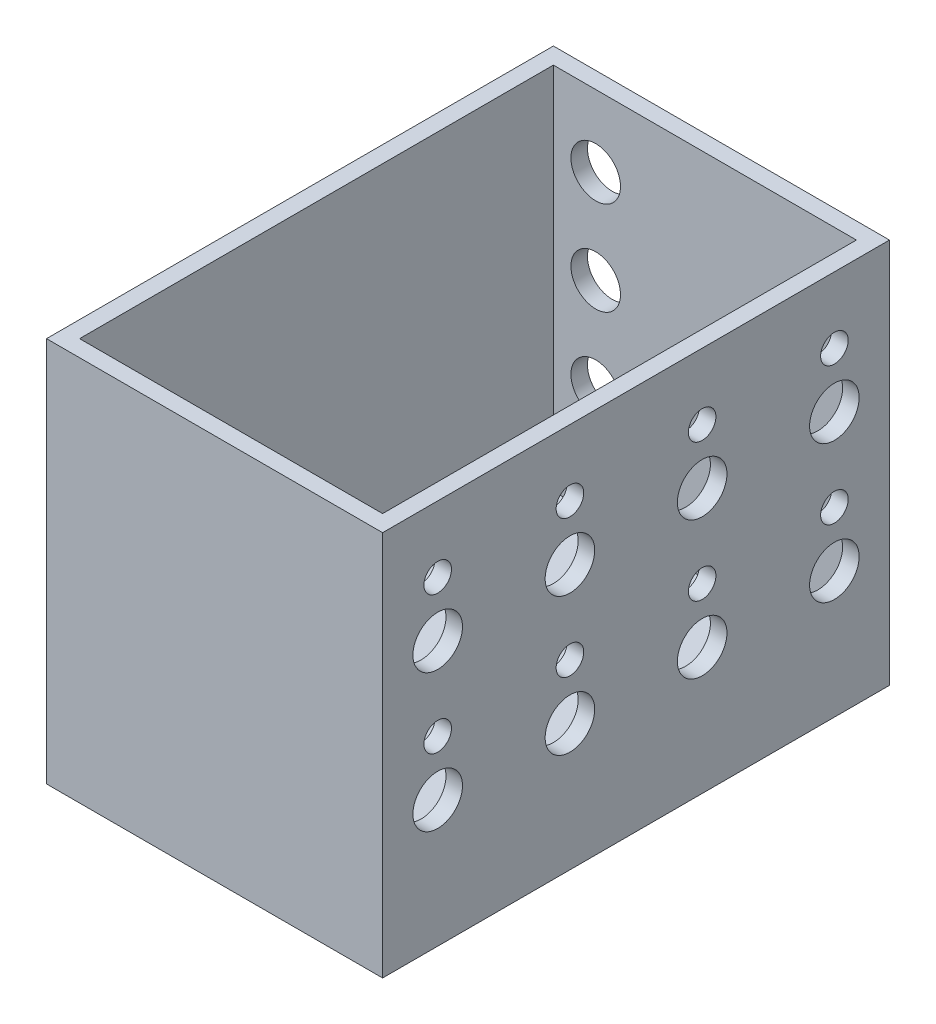
from build123d import *

# Parameters (mm, degrees)
SKETCH1_W           = 55
SKETCH1_H           = 86
BOSS_EXTRUDE1_DEPTH = 3
SKETCH2_W           = 45
SKETCH2_H           = 45
CUT_EXTRUDE1_DEPTH  = 1.5
SKETCH3_W           = 61
SKETCH3_H           = 92
SKETCH3_W_2         = 55
SKETCH3_H_2         = 86
BOSS_EXTRUDE2_DEPTH = 70
SKETCH4_R           = 4.5
SKETCH4_R_2         = 2.5
CUT_EXTRUDE2_DEPTH  = 3
SKETCH5_R           = 4.5
CUT_EXTRUDE3_DEPTH  = 3


with BuildPart() as part:
    # Sketch1 → Boss-Extrude1 (new body)
    with BuildSketch(Plane(origin=(0, 0, 0), x_dir=(1, 0, 0), z_dir=(0, 1, 0))):
        Rectangle(SKETCH1_W, SKETCH1_H)
    extrude(amount=BOSS_EXTRUDE1_DEPTH)

    # Sketch2 → Cut-Extrude1 (cut)
    with BuildSketch(Plane(origin=(0, 3, 0), x_dir=(1, 0, 0), z_dir=(0, 1, 0))):
        Rectangle(SKETCH2_W, SKETCH2_H)
    extrude(amount=-CUT_EXTRUDE1_DEPTH, mode=Mode.SUBTRACT)

    # Sketch3 → Boss-Extrude2 (add)
    with BuildSketch(Plane(origin=(0, 0, 0), x_dir=(1, 0, 0), z_dir=(0, 1, 0))):
        Rectangle(SKETCH3_W, SKETCH3_H)
        Rectangle(SKETCH3_W_2, SKETCH3_H_2, mode=Mode.SUBTRACT)
    extrude(amount=BOSS_EXTRUDE2_DEPTH)

    # Sketch4 → Cut-Extrude2 (cut)
    with BuildSketch(Plane(origin=(30.5, 0, 0), x_dir=(0, 0, -1), z_dir=(1, 0, 0))):
        with Locations((-36, 48)):
            Circle(SKETCH4_R)
        with Locations((-12, 48)):
            Circle(SKETCH4_R)
        with Locations((12, 48)):
            Circle(SKETCH4_R)
        with Locations((36, 48)):
            Circle(SKETCH4_R)
        with Locations((36, 23)):
            Circle(SKETCH4_R)
        with Locations((12, 23)):
            Circle(SKETCH4_R)
        with Locations((-12, 23)):
            Circle(SKETCH4_R)
        with Locations((-36, 23)):
            Circle(SKETCH4_R)
        with Locations((-36, 33)):
            Circle(SKETCH4_R_2)
        with Locations((-12, 33)):
            Circle(SKETCH4_R_2)
        with Locations((12, 33)):
            Circle(SKETCH4_R_2)
        with Locations((36, 33)):
            Circle(SKETCH4_R_2)
        with Locations((36, 58)):
            Circle(SKETCH4_R_2)
        with Locations((12, 58)):
            Circle(SKETCH4_R_2)
        with Locations((-12, 58)):
            Circle(SKETCH4_R_2)
        with Locations((-36, 58)):
            Circle(SKETCH4_R_2)
    extrude(amount=-CUT_EXTRUDE2_DEPTH, mode=Mode.SUBTRACT)

    # Sketch5 → Cut-Extrude3 (cut)
    with BuildSketch(Plane(origin=(0, 0, -46), x_dir=(-1, 0, 0), z_dir=(0, 0, -1))):
        with Locations((19.818640834, 23)):
            Circle(SKETCH5_R)
        with Locations((19.818640834, 40)):
            Circle(SKETCH5_R)
        with Locations((19.818640834, 57)):
            Circle(SKETCH5_R)
    extrude(amount=-CUT_EXTRUDE3_DEPTH, mode=Mode.SUBTRACT)


solid = part.part
